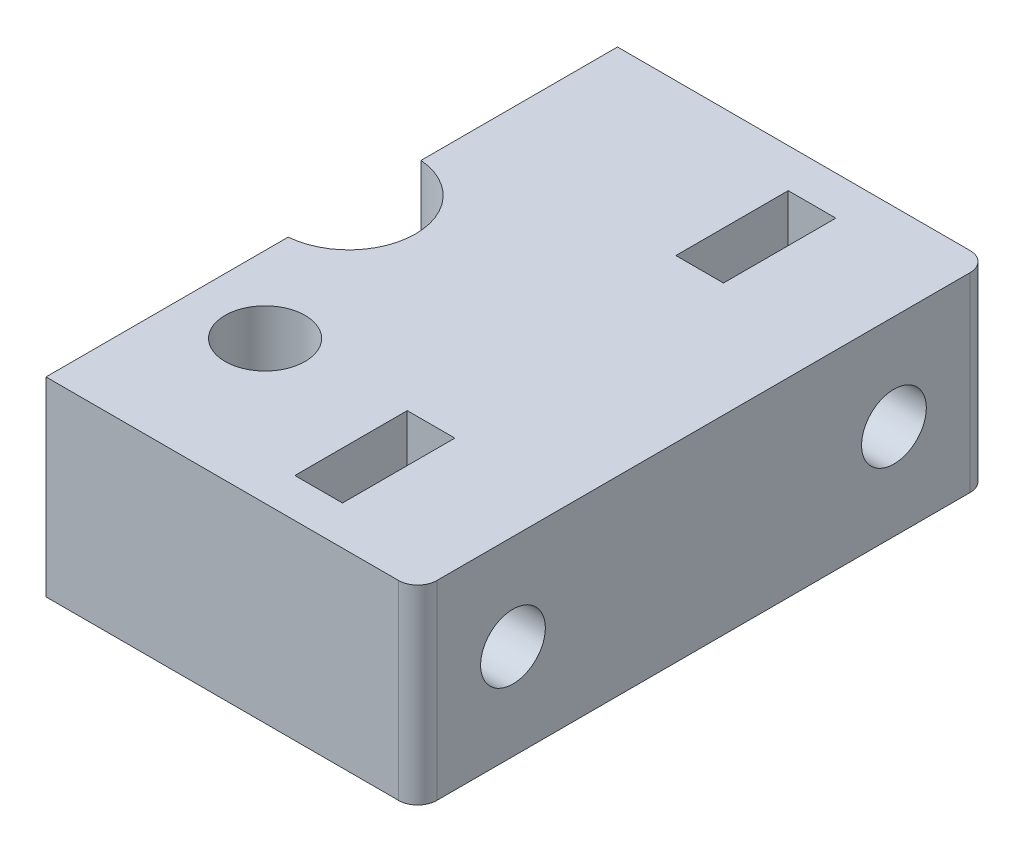
from build123d import *

# Parameters (mm, degrees)
SKETCH1_W           = 59.0272
SKETCH1_H           = 30
BOSS_EXTRUDE1_DEPTH = 10
SKETCH2_R           = 2.1
CUT_EXTRUDE1_DEPTH  = 35.58399319
SKETCH3_R           = 1.7
CUT_EXTRUDE2_DEPTH  = 12
SKETCH4_R           = 1.65
CUT_EXTRUDE3_DEPTH  = 12
CUT_EXTRUDE4_DEPTH  = 2.5
CUT_EXTRUDE5_DEPTH  = 2.3
SKETCH7_R           = 3.5
CUT_EXTRUDE6_DEPTH  = 35.58399319
FILLET1_R           = 1
SKETCH8_W           = 39.5136
SKETCH8_H           = 30
CUT_EXTRUDE7_DEPTH  = 35.58399319


with BuildPart() as part:
    # Sketch1 → Boss-Extrude1 (new body)
    with BuildSketch(Plane(origin=(0, 0, 0), x_dir=(1, 0, 0), z_dir=(0, 1, 0))):
        Rectangle(SKETCH1_W, SKETCH1_H)
    extrude(amount=BOSS_EXTRUDE1_DEPTH)

    # Sketch2 → Cut-Extrude1 (cut, through all)
    with BuildSketch(Plane(origin=(0, 10, 0), x_dir=(1, 0, 0), z_dir=(0, 1, 0))):
        with Locations(Location((-6, -7.5, 0), (0, 0, 270))):
            Circle(SKETCH2_R)
        with Locations(Location((14, -7.5, 0), (0, 0, 270))):
            Circle(SKETCH2_R)
    extrude(amount=-CUT_EXTRUDE1_DEPTH, mode=Mode.SUBTRACT)

    # Sketch3 → Cut-Extrude2 (cut)
    with BuildSketch(Plane(origin=(29.5136, 0, 0), x_dir=(0, 0, -1), z_dir=(1, 0, 0))):
        with Locations((-10, 5)):
            Circle(SKETCH3_R)
        with Locations((10, 5)):
            Circle(SKETCH3_R)
    extrude(amount=-CUT_EXTRUDE2_DEPTH, mode=Mode.SUBTRACT)

    # Sketch4 → Cut-Extrude3 (cut)
    with BuildSketch(Plane.ZY.offset(29.5136)):
        with Locations((-10, 5)):
            Circle(SKETCH4_R)
        with Locations((10, 5)):
            Circle(SKETCH4_R)
    extrude(amount=-CUT_EXTRUDE3_DEPTH, mode=Mode.SUBTRACT)

    # Sketch5 → Cut-Extrude4 (cut)
    with BuildSketch(Plane(origin=(23.5136, 0, 0), x_dir=(0, 0, -1), z_dir=(1, 0, 0))):
        Polygon((-12.95, 6.703183294), (-12.95, 10), (-7.05, 10), (-7.05, 6.703183294), (-7.05, 3.296816706), (-10, 1.593633412), (-12.95, 3.296816706), align=None)
        Polygon((7.05, 6.703183294), (7.05, 3.296816706), (10, 1.593633412), (12.95, 3.296816706), (12.95, 6.703183294), (12.95, 10), (7.05, 10), align=None)
    extrude(amount=-CUT_EXTRUDE4_DEPTH, mode=Mode.SUBTRACT)

    # Sketch6 → Cut-Extrude5 (cut)
    with BuildSketch(Plane.ZY.offset(23.5136)):
        Polygon((-12.85, 6.645448267), (-12.85, 10), (-7.15, 10), (-7.15, 6.645448267), (-7.15, 3.354551733), (-10, 1.709103466), (-12.85, 3.354551733), align=None)
        Polygon((7.15, 6.645448267), (7.15, 3.354551733), (10, 1.709103466), (12.85, 3.354551733), (12.85, 6.645448267), (12.85, 10), (7.15, 10), align=None)
    extrude(amount=-CUT_EXTRUDE5_DEPTH, mode=Mode.SUBTRACT)

    # Sketch7 → Cut-Extrude6 (cut, through all)
    with BuildSketch(Plane(origin=(0, 10, 0), x_dir=(1, 0, 0), z_dir=(0, 1, 0))):
        with Locations(Location((9.7, 1.2, 0), (0, 0, 270))):
            Circle(SKETCH7_R)
        with Locations(Location((-15.7, 1.2, 0), (0, 0, 270))):
            Circle(SKETCH7_R)
    extrude(amount=-CUT_EXTRUDE6_DEPTH, mode=Mode.SUBTRACT)

    # Fillet1
    fillet1_edges = [part.edges().sort_by_distance(p)[0] for p in [
        (29.5136, 5, 15),
        (-29.5136, 5, 15),
        (-29.5136, 5, -15),
        (29.5136, 5, -15),
    ]]
    fillet(fillet1_edges, radius=FILLET1_R)

    # Sketch8 → Cut-Extrude7 (cut, through all)
    with BuildSketch(Plane(origin=(0, 10, 0), x_dir=(1, 0, 0), z_dir=(0, 1, 0))):
        with Locations((-9.7568, 0)):
            Rectangle(SKETCH8_W, SKETCH8_H)
    extrude(amount=-CUT_EXTRUDE7_DEPTH, mode=Mode.SUBTRACT)


solid = part.part
